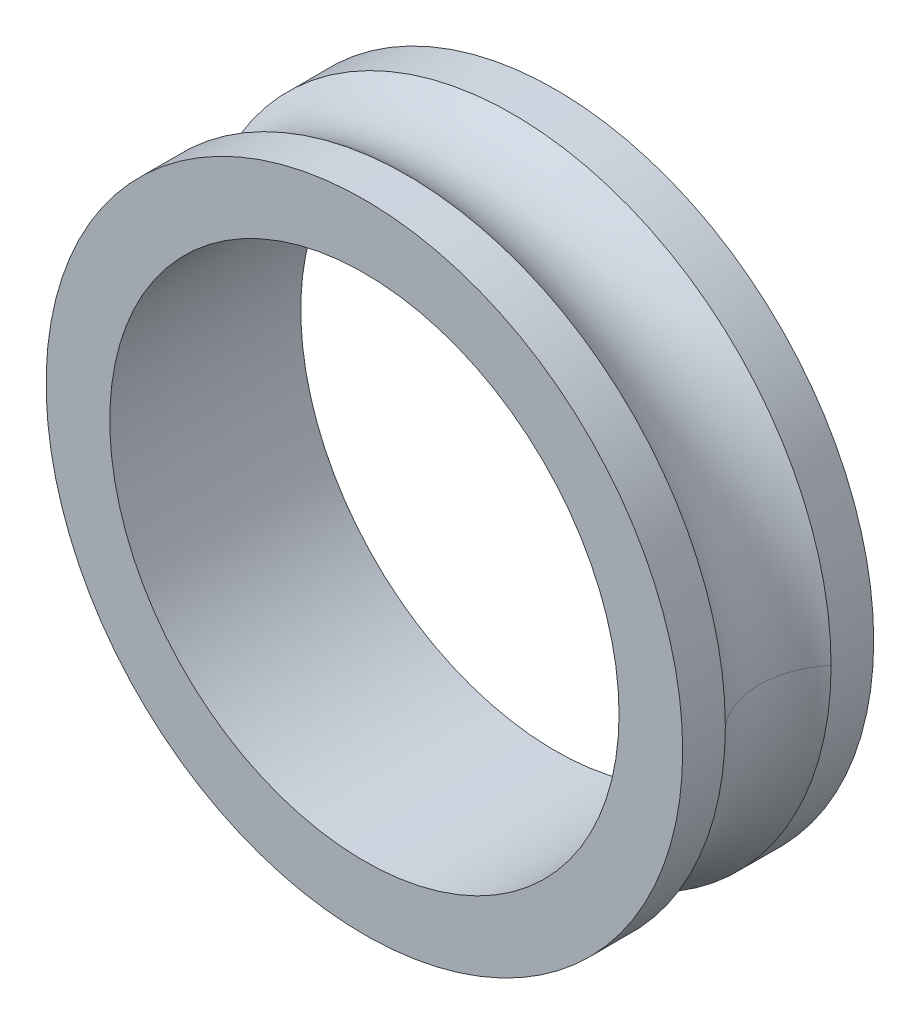
from build123d import *

# Parameters (mm, degrees)
SKETCH1_R           = 25
SKETCH1_R_2         = 20
BOSS_EXTRUDE1_DEPTH = 7.5
SKETCH4_R           = 6.5


with BuildPart() as part:
    # Sketch1 → Boss-Extrude1 (new, symmetric)
    with BuildSketch(Plane.XY):
        Circle(SKETCH1_R)
        Circle(SKETCH1_R_2, mode=Mode.SUBTRACT)
    extrude(amount=BOSS_EXTRUDE1_DEPTH, both=True)

    # Cut-Sweep2: sweep along a curve in space
    with BuildLine() as cut_sweep2_path:
        ThreePointArc((25, 0, 7.5), (17.67766953, 17.67766953, 7.5), (0, 25, 7.5))
        ThreePointArc((0, 25, 7.5), (-17.67766953, 17.67766953, 7.5), (-25, 0, 7.5))
        ThreePointArc((-25, 0, 7.5), (-17.67766953, -17.67766953, 7.5), (0, -25, 7.5))
        ThreePointArc((0, -25, 7.5), (17.67766953, -17.67766953, 7.5), (25, 0, 7.5))
    # Sketch4 → Cut-Sweep2 (sweep, cut)
    with BuildSketch(Plane(origin=(0, 0, 0), x_dir=(0, 0, -1), z_dir=(1, 0, 0))):
        with Locations((0, -30)):
            Circle(SKETCH4_R)
    sweep(path=cut_sweep2_path.line, mode=Mode.SUBTRACT)


solid = part.part
